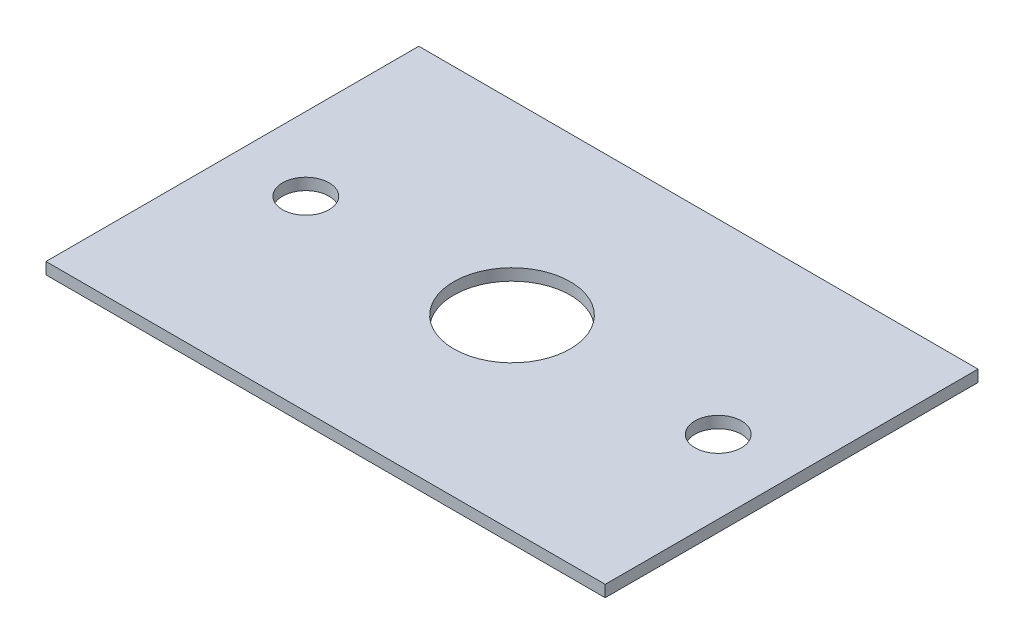
from build123d import *

# Parameters (mm, degrees)
SKETCH1_W           = 76.2
SKETCH1_H           = 50.8
SKETCH1_R           = 7.9375
SKETCH1_R_2         = 3.175
BOSS_EXTRUDE1_DEPTH = 1.5875


with BuildPart() as part:
    # Sketch1 → Boss-Extrude1 (new body)
    with BuildSketch(Plane(origin=(0, 0, 0), x_dir=(1, 0, 0), z_dir=(0, 1, 0))):
        Rectangle(SKETCH1_W, SKETCH1_H)
        with Locations(Location((0, 0, 0), (0, 0, 270))):
            Circle(SKETCH1_R, mode=Mode.SUBTRACT)
        with Locations(Location((-28.1, 0, 0), (0, 0, 270))):
            Circle(SKETCH1_R_2, mode=Mode.SUBTRACT)
        with Locations(Location((28.1, 0, 0), (0, 0, 270))):
            Circle(SKETCH1_R_2, mode=Mode.SUBTRACT)
    extrude(amount=BOSS_EXTRUDE1_DEPTH)


solid = part.part
